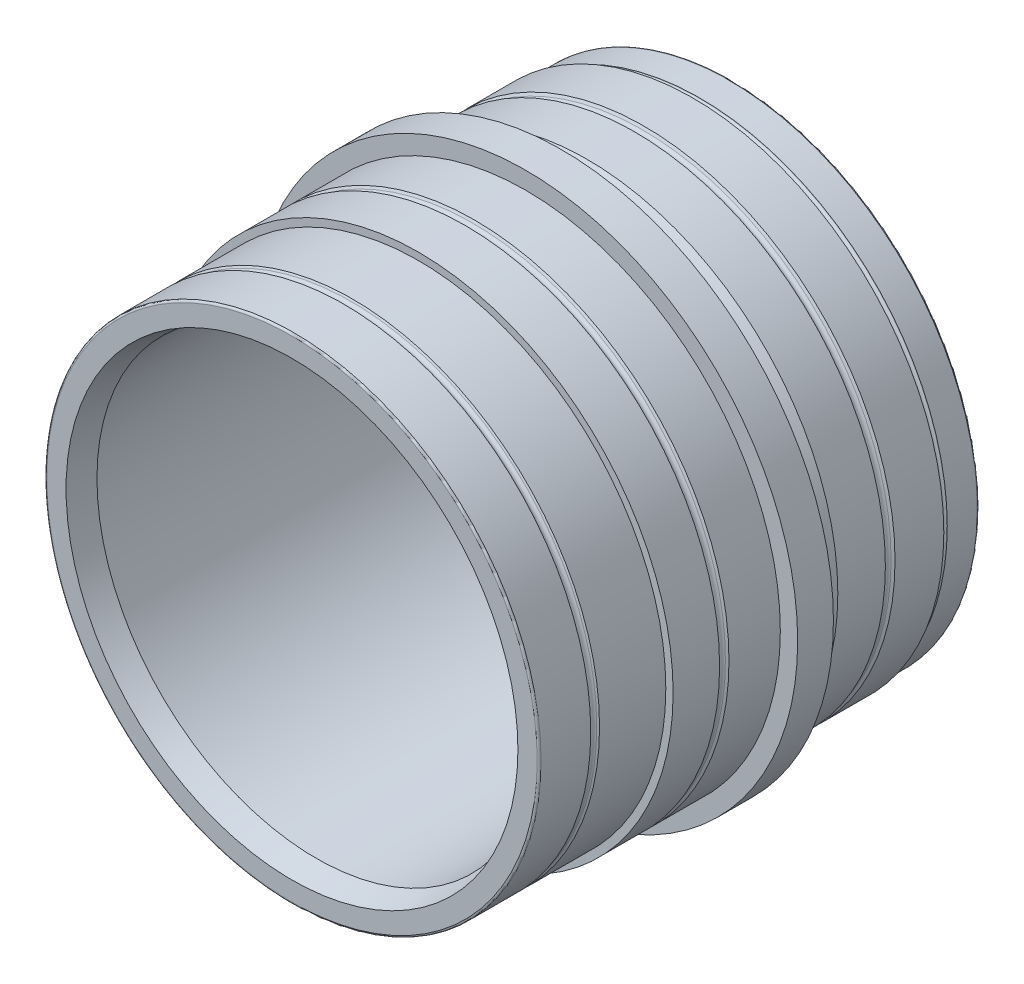
from build123d import *


with BuildPart() as part:
    # Sketch1 → Revolve1 (revolve)
    with BuildSketch(Plane(origin=(0, 0, 0), x_dir=(0, 0, -1), z_dir=(1, 0, 0)), mode=Mode.PRIVATE) as revolve1_sk:
        with BuildLine():
            Line((0, 23.182372981), (2.5, 22.5125))
            Line((2.5, 22.5125), (42.65, 22.5125))
            Line((42.65, 22.5125), (45.15, 23.182372981))
            Line((45.15, 23.182372981), (45.15, 25.1575))
            ThreePointArc((45.15, 25.1575), (45.091421356, 25.298921356), (44.95, 25.3575))
            Line((44.95, 25.3575), (41.880348091, 25.3575))
            Line((41.880348091, 25.3575), (41.861584207, 25.325))
            ThreePointArc((41.861584207, 25.325), (41.515174045, 25.125), (41.168763884, 25.325))
            Line((41.168763884, 25.325), (41.15, 25.3575))
            Line((41.15, 25.3575), (41.15, 25.7325))
            Line((41.15, 25.7325), (36.145077856, 25.7325))
            Line((36.145077856, 25.7325), (35.996410162, 25.475))
            ThreePointArc((35.996410162, 25.475), (35.65, 25.275), (35.303589838, 25.475))
            Line((35.303589838, 25.475), (35.154922144, 25.7325))
            Line((35.154922144, 25.7325), (30.275, 25.7325))
            Line((30.275, 25.7325), (29.313996917, 25.475))
            Line((29.313996917, 25.475), (28.775, 25.475))
            ThreePointArc((28.775, 25.475), (28.421446609, 25.621446609), (28.275, 25.975))
            Line((28.275, 25.975), (28.275, 26.8375))
            Line((28.275, 26.8375), (27.668782217, 27.8875))
            Line((27.668782217, 27.8875), (24, 27.8875))
            Line((24, 27.8875), (24, 26.1075))
            Line((24, 26.1075), (18.730644099, 26.1075))
            Line((18.730644099, 26.1075), (18.596410162, 25.875))
            ThreePointArc((18.596410162, 25.875), (18.25, 25.675), (17.903589838, 25.875))
            Line((17.903589838, 25.875), (17.769355901, 26.1075))
            Line((17.769355901, 26.1075), (13, 26.1075))
            Line((13, 26.1075), (13, 25.3575))
            Line((13, 25.3575), (6.201776586, 25.3575))
            Line((6.201776586, 25.3575), (6.096410162, 25.175))
            ThreePointArc((6.096410162, 25.175), (5.75, 24.975), (5.403589838, 25.175))
            Line((5.403589838, 25.175), (5.298223414, 25.3575))
            Line((5.298223414, 25.3575), (0.2, 25.3575))
            ThreePointArc((0.2, 25.3575), (0.058578644, 25.298921356), (0, 25.1575))
            Line((0, 25.1575), (0, 23.182372981))
        make_face()
    revolve(revolve1_sk.sketch.rotate(Axis((0, 0, 0), (0, 0, -1)), 90), axis=Axis((0, 0, 0), (0, 0, -1)))


solid = part.part
